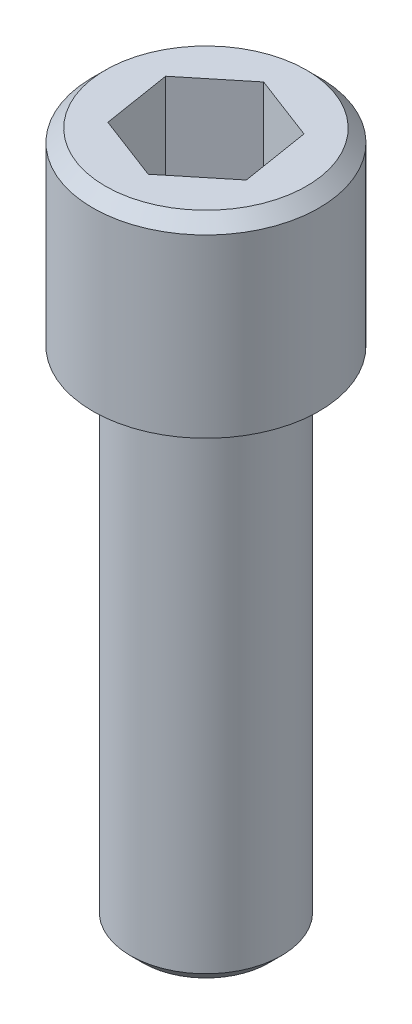
from build123d import *

# Parameters (mm, degrees)
SKICA1_R                 = 1.5
P_IDAT_VYSUNUT_M1_DEPTH  = 10
SKICA2_R                 = 2.25
P_IDAT_VYSUNUT_M2_DEPTH  = 3.75
ODEBRAT_VYSUNUT_M1_DEPTH = 2.25
ZKOSEN_1_SIZE            = 0.25
ZKOSEN_2_SIZE            = 0.25


with BuildPart() as part:
    # Skica1 → Přidat vysunutím1 (new body)
    with BuildSketch(Plane(origin=(0, 0, 0), x_dir=(1, 0, 0), z_dir=(0, 1, 0))):
        with Locations(Location((0, 0, 0), (0, 0, 270))):
            Circle(SKICA1_R)
    extrude(amount=P_IDAT_VYSUNUT_M1_DEPTH)

    # Skica2 → Přidat vysunutím2 (add)
    with BuildSketch(Plane(origin=(0, 10, 0), x_dir=(1, 0, 0), z_dir=(0, 1, 0))):
        with Locations(Location((0, 0, 0), (0, 0, 270))):
            Circle(SKICA2_R)
    extrude(amount=P_IDAT_VYSUNUT_M2_DEPTH)

    # Skica3 → Odebrat vysunutím1 (cut)
    with BuildSketch(Plane(origin=(0, 13.75, 0), x_dir=(1, 0, 0), z_dir=(0, 1, 0))):
        Polygon((-1.074402598, -0.875019461), (0.220587783, -1.367969674), (1.294990381, -0.492950213), (1.074402598, 0.875019461), (-0.220587783, 1.367969674), (-1.294990381, 0.492950213), align=None)
    extrude(amount=-ODEBRAT_VYSUNUT_M1_DEPTH, mode=Mode.SUBTRACT)

    # Zkosení1
    zkosen_1_edges = [part.edges().sort_by_distance(p)[0] for p in [
        (0, 13.75, -2.25),
    ]]
    chamfer(zkosen_1_edges, length=ZKOSEN_1_SIZE)

    # Zkosení2
    zkosen_2_edges = [part.edges().sort_by_distance(p)[0] for p in [
        (0, 0, -1.5),
    ]]
    chamfer(zkosen_2_edges, length=ZKOSEN_2_SIZE)


solid = part.part
